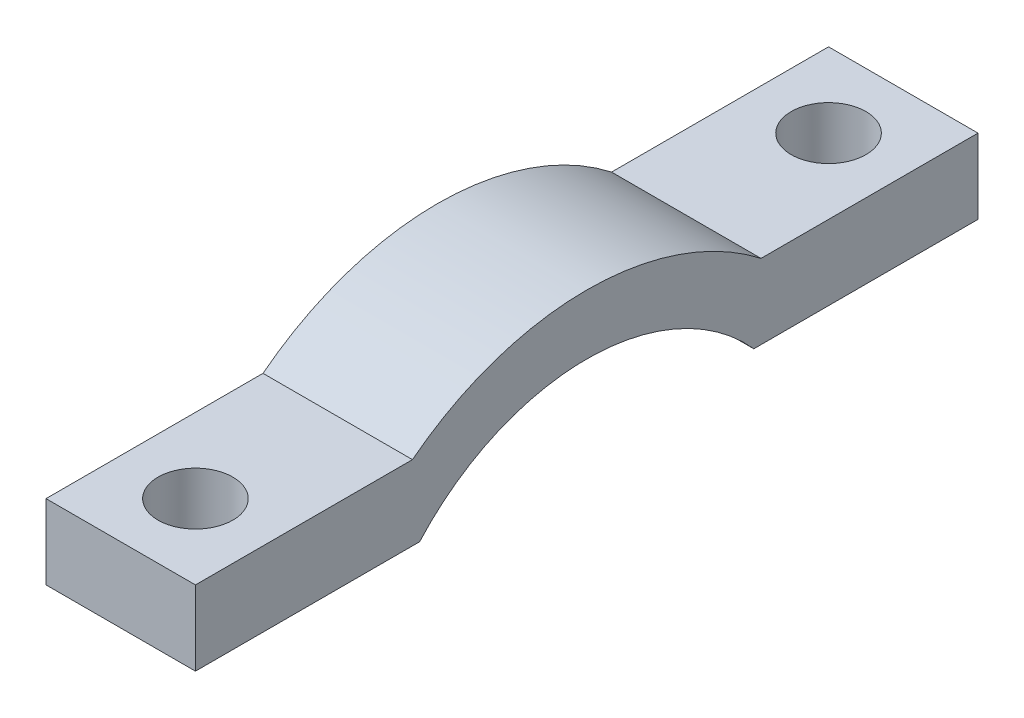
from build123d import *

# Parameters (mm, degrees)
BASE_DEPTH           = 10
ESQUISSE5_R          = 2.5
VIDE_ACCES_VIS_DEPTH = 30.434846638


with BuildPart() as part:
    # Esquisse2 → BASE (new body)
    with BuildSketch(Plane(origin=(0, 0, 0), x_dir=(0, 0, -1), z_dir=(1, 0, 0))):
        with BuildLine():
            Line((-26.180339887, 10), (-14.361406616, 10))
            Line((-14.361406616, 10), (-11.180339887, 10))
            ThreePointArc((-11.180339887, 10), (0, 15), (11.180339887, 10))
            Line((11.180339887, 10), (14.361406616, 10))
            Line((14.361406616, 10), (21.180339887, 10))
            Line((21.180339887, 10), (26.180339887, 10))
            Line((26.180339887, 10), (26.180339887, 15))
            Line((26.180339887, 15), (11.66190379, 15))
            ThreePointArc((11.66190379, 15), (0, 19), (-11.66190379, 15))
            Line((-11.66190379, 15), (-26.180339887, 15))
            Line((-26.180339887, 15), (-26.180339887, 10))
        make_face()
    extrude(amount=BASE_DEPTH)

    # Esquisse5 → VIDE ACCES VIS (cut, through all)
    with BuildSketch(Plane.XZ.offset(-10)):
        with Locations(Location((5, 21.180339887, 0), (0, 0, 270))):
            Circle(ESQUISSE5_R)
        with Locations(Location((5, -21.180339887, 0), (0, 0, 270))):
            Circle(ESQUISSE5_R)
    extrude(amount=-VIDE_ACCES_VIS_DEPTH, mode=Mode.SUBTRACT)


solid = part.part
